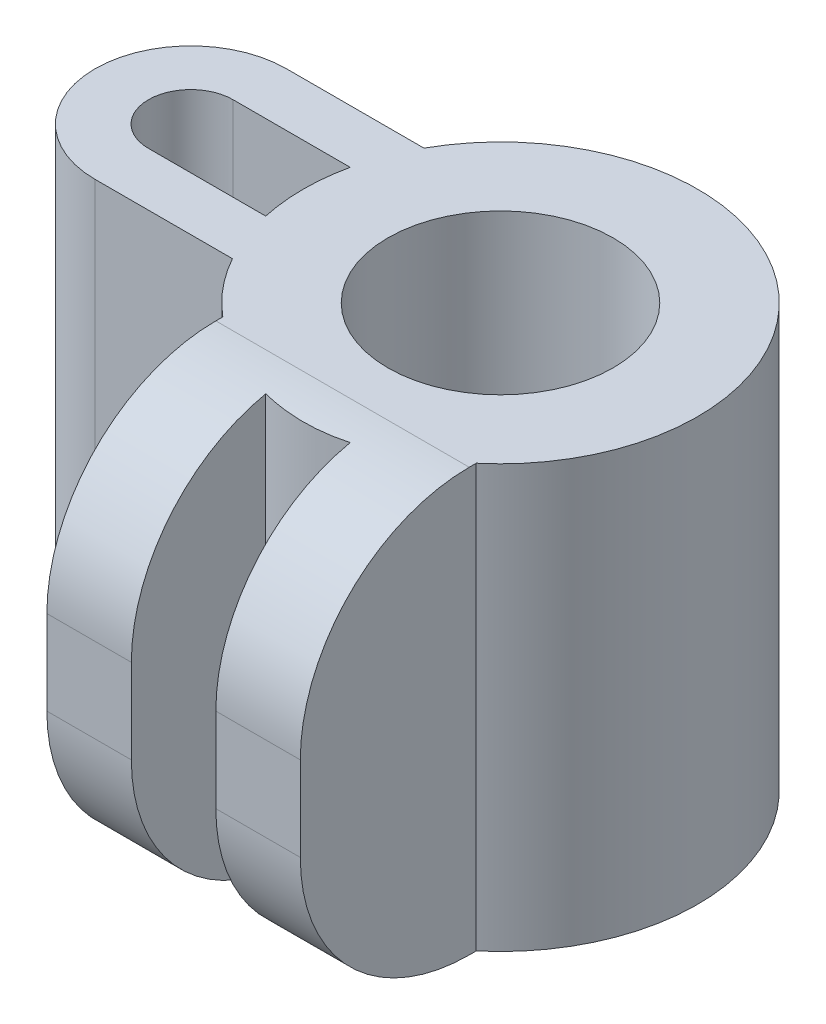
from build123d import *

# Parameters (mm, degrees)
SKETCH1_R           = 35
SKETCH1_R_2         = 20
BOSS_EXTRUDE6_DEPTH = 75
FILLET1_R           = 30


with BuildPart() as part:
    # Sketch1 → Boss-Extrude6 (new body)
    # profile 1 of 4: a face of its own
    with BuildSketch(Plane(origin=(0, 0, 0), x_dir=(1, 0, 0), z_dir=(0, 1, 0))):
        with BuildLine():
            ThreePointArc((-7.5, -34.186985828), (-15.446901808, -31.406897722), (-22.5, -26.809513237))
            Line((-22.5, -26.809513237), (-22.5, -58.046407186))
            Line((-22.5, -58.046407186), (-7.5, -58.046407186))
            Line((-7.5, -58.046407186), (-7.5, -34.186985828))
        make_face()
    # profile 2 of 4: a face of its own
    with BuildSketch(Plane(origin=(0, 0, 0), x_dir=(1, 0, 0), z_dir=(0, 1, 0))):
        with BuildLine():
            Line((22.5, -58.046407186), (22.5, -26.809513237))
            ThreePointArc((22.5, -26.809513237), (15.446901808, -31.406897722), (7.5, -34.186985828))
            Line((7.5, -34.186985828), (7.5, -58.046407186))
            Line((7.5, -58.046407186), (22.5, -58.046407186))
        make_face()
    # profile 3 of 4: a face of its own
    with BuildSketch(Plane(origin=(0, 0, 0), x_dir=(1, 0, 0), z_dir=(0, 1, 0))):
        Circle(SKETCH1_R)
        with Locations(Location((0, 0, 0), (0, 0, 270))):
            Circle(SKETCH1_R_2, mode=Mode.SUBTRACT)
    # profile 4 of 4: a face of its own
    with BuildSketch(Plane(origin=(0, 0, 0), x_dir=(1, 0, 0), z_dir=(0, 1, 0))):
        with BuildLine():
            ThreePointArc((-55, -7.5), (-62.5, 0), (-55, 7.5))
            Line((-55, 7.5), (-34.186985828, 7.5))
            ThreePointArc((-34.186985828, 7.5), (-32.736987087, 12.381020816), (-30.594117082, 17))
            Line((-30.594117082, 17), (-55, 17))
            ThreePointArc((-55, 17), (-72, 0), (-55, -17))
            Line((-55, -17), (-30.594117082, -17))
            ThreePointArc((-30.594117082, -17), (-32.736987087, -12.381020816), (-34.186985828, -7.5))
            Line((-34.186985828, -7.5), (-55, -7.5))
        make_face()
    extrude(amount=BOSS_EXTRUDE6_DEPTH)

    # Fillet1
    fillet1_edges = [part.edges().sort_by_distance(p)[0] for p in [
        (-15, 0, 58.046407186),
        (-15, 75, 58.046407186),
    ]]
    fillet(fillet1_edges, radius=FILLET1_R)


solid = part.part
